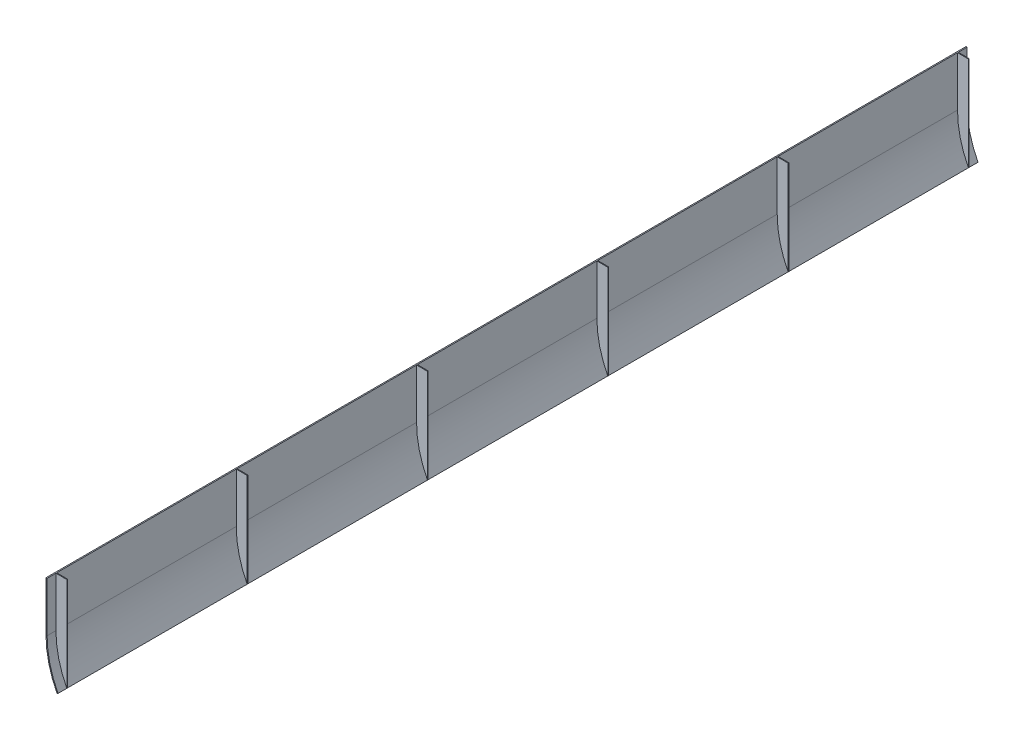
from build123d import *

# Parameters (mm, degrees)
SURFACE_EXTRUDE1_1_DEPTH = 2500
THICKEN1_T1              = 3
BOSS_EXTRUDE1_REACH      = 2515.396
SKETCH2_W                = 29.660018132
SKETCH2_H                = 2


with BuildPart() as body_1:
    # Surface-Extrude1: a surface, the sketch's curves swept straight by 2500 mm
    with BuildLine(Plane.XY, mode=Mode.PRIVATE) as surface_extrude1_1_path:
        Line((-30, 257.405882212), (-30, 122.405882212))
        ThreePointArc((-30, 122.405882212), (-22.390634553, 59.391598117), (0, 0))
    surface_extrude1_1 = Shell.extrude(surface_extrude1_1_path.wire(), (0 * SURFACE_EXTRUDE1_1_DEPTH, 0 * SURFACE_EXTRUDE1_1_DEPTH, 1 * SURFACE_EXTRUDE1_1_DEPTH))
    add(Solid.thicken(surface_extrude1_1, THICKEN1_T1))

    # Sketch2 → Boss-Extrude1 (add, up to next)
    with BuildSketch(Plane(origin=(0, 257.405882212, 0), x_dir=(1, 0, 0), z_dir=(0, 1, 0)), mode=Mode.PRIVATE) as boss_extrude1_sk1:
        with Locations((-12.169990934, -2475)):
            Rectangle(SKETCH2_W, SKETCH2_H)
    boss_extrude1_tool1 = extrude(boss_extrude1_sk1.sketch, amount=-BOSS_EXTRUDE1_REACH, mode=Mode.PRIVATE) - body_1.part
    # Sketch2 → Boss-Extrude1 (add, up to next)
    with BuildSketch(Plane(origin=(0, 257.405882212, 0), x_dir=(1, 0, 0), z_dir=(0, 1, 0)), mode=Mode.PRIVATE) as boss_extrude1_sk2:
        with Locations((-12.169990934, -1985)):
            Rectangle(SKETCH2_W, SKETCH2_H)
    boss_extrude1_tool2 = extrude(boss_extrude1_sk2.sketch, amount=-BOSS_EXTRUDE1_REACH, mode=Mode.PRIVATE) - body_1.part
    # Sketch2 → Boss-Extrude1 (add, up to next)
    with BuildSketch(Plane(origin=(0, 257.405882212, 0), x_dir=(1, 0, 0), z_dir=(0, 1, 0)), mode=Mode.PRIVATE) as boss_extrude1_sk3:
        with Locations((-12.169990934, -1495)):
            Rectangle(SKETCH2_W, SKETCH2_H)
    boss_extrude1_tool3 = extrude(boss_extrude1_sk3.sketch, amount=-BOSS_EXTRUDE1_REACH, mode=Mode.PRIVATE) - body_1.part
    # Sketch2 → Boss-Extrude1 (add, up to next)
    with BuildSketch(Plane(origin=(0, 257.405882212, 0), x_dir=(1, 0, 0), z_dir=(0, 1, 0)), mode=Mode.PRIVATE) as boss_extrude1_sk4:
        with Locations((-12.169990934, -1005)):
            Rectangle(SKETCH2_W, SKETCH2_H)
    boss_extrude1_tool4 = extrude(boss_extrude1_sk4.sketch, amount=-BOSS_EXTRUDE1_REACH, mode=Mode.PRIVATE) - body_1.part
    # Sketch2 → Boss-Extrude1 (add, up to next)
    with BuildSketch(Plane(origin=(0, 257.405882212, 0), x_dir=(1, 0, 0), z_dir=(0, 1, 0)), mode=Mode.PRIVATE) as boss_extrude1_sk5:
        with Locations((-12.169990934, -515)):
            Rectangle(SKETCH2_W, SKETCH2_H)
    boss_extrude1_tool5 = extrude(boss_extrude1_sk5.sketch, amount=-BOSS_EXTRUDE1_REACH, mode=Mode.PRIVATE) - body_1.part
    # Sketch2 → Boss-Extrude1 (add, up to next)
    with BuildSketch(Plane(origin=(0, 257.405882212, 0), x_dir=(1, 0, 0), z_dir=(0, 1, 0)), mode=Mode.PRIVATE) as boss_extrude1_sk6:
        with Locations((-12.169990934, -25)):
            Rectangle(SKETCH2_W, SKETCH2_H)
    boss_extrude1_tool6 = extrude(boss_extrude1_sk6.sketch, amount=-BOSS_EXTRUDE1_REACH, mode=Mode.PRIVATE) - body_1.part
    add(boss_extrude1_tool1.solids().sort_by_distance((-12.169991, 257.405882, 2475))[0])
    add(boss_extrude1_tool2.solids().sort_by_distance((-12.169991, 257.405882, 1985))[0])
    add(boss_extrude1_tool3.solids().sort_by_distance((-12.169991, 257.405882, 1495))[0])
    add(boss_extrude1_tool4.solids().sort_by_distance((-12.169991, 257.405882, 1005))[0])
    add(boss_extrude1_tool5.solids().sort_by_distance((-12.169991, 257.405882, 515))[0])
    add(boss_extrude1_tool6.solids().sort_by_distance((-12.169991, 257.405882, 25))[0])


solid = body_1.part
